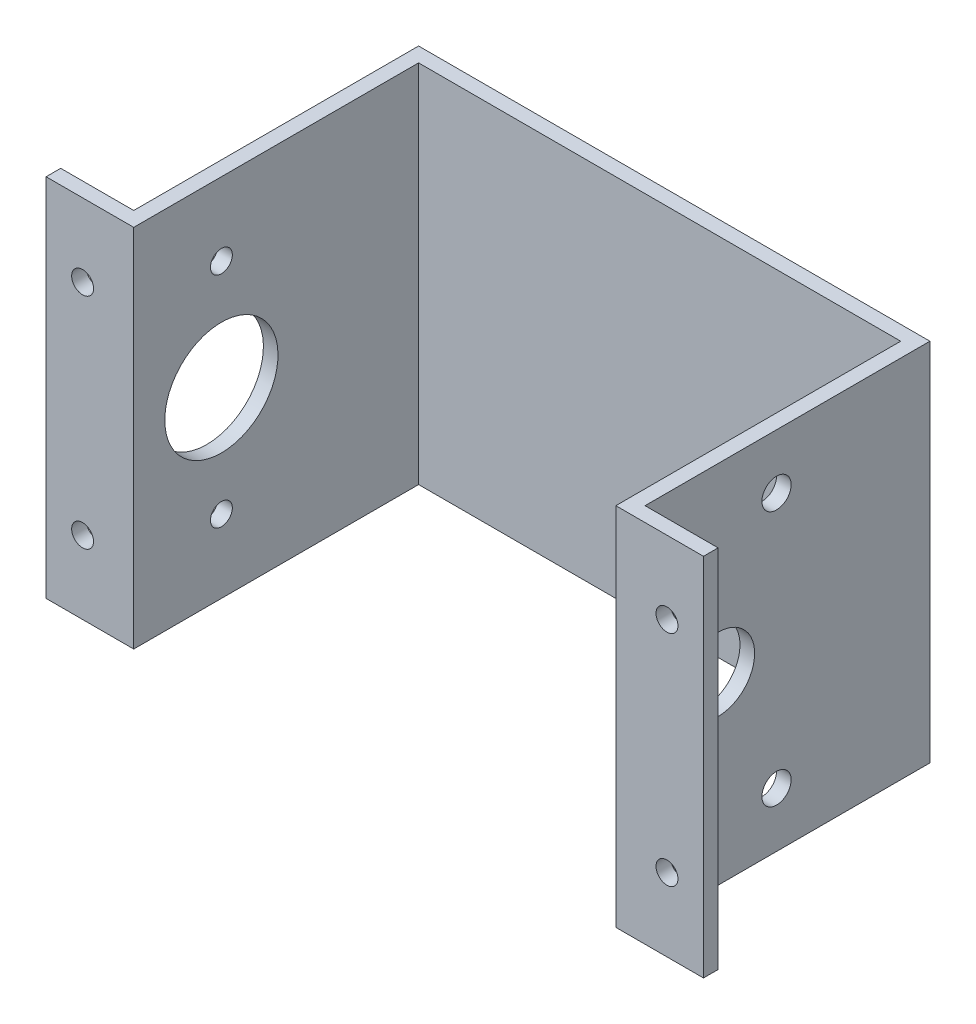
from build123d import *

# Parameters (mm, degrees)
SKETCH1_W           = 70
SKETCH1_H           = 50
BOSS_EXTRUDE1_DEPTH = 2
SKETCH2_W           = 2
SKETCH2_H           = 50
BOSS_EXTRUDE2_DEPTH = 37
SKETCH3_W           = 12
SKETCH3_H           = 50
BOSS_EXTRUDE3_DEPTH = 2
SKETCH4_R           = 5
SKETCH4_R_2         = 2
CUT_EXTRUDE1_DEPTH  = 2
SKETCH5_R           = 7.75
SKETCH5_R_2         = 1.5
CUT_EXTRUDE2_DEPTH  = 2
SKETCH6_R           = 1.5
CUT_EXTRUDE3_DEPTH  = 2


with BuildPart() as part:
    # Sketch1 → Boss-Extrude1 (new body)
    with BuildSketch(Plane.XY):
        Rectangle(SKETCH1_W, SKETCH1_H)
    extrude(amount=BOSS_EXTRUDE1_DEPTH)

    # Sketch2 → Boss-Extrude2 (add)
    with BuildSketch(Plane.XY.offset(2)):
        with Locations((34, 0)):
            Rectangle(SKETCH2_W, SKETCH2_H)
        with Locations((-34, 0)):
            Rectangle(SKETCH2_W, SKETCH2_H)
    extrude(amount=BOSS_EXTRUDE2_DEPTH)

    # Sketch3 → Boss-Extrude3 (add)
    with BuildSketch(Plane.XY.offset(39)):
        with Locations((39, 0)):
            Rectangle(SKETCH3_W, SKETCH3_H)
        with Locations((-39, 0)):
            Rectangle(SKETCH3_W, SKETCH3_H)
    extrude(amount=BOSS_EXTRUDE3_DEPTH)

    # Sketch4 → Cut-Extrude1 (cut)
    with BuildSketch(Plane(origin=(35, 0, 0), x_dir=(0, 0, -1), z_dir=(1, 0, 0))):
        with Locations(Location((-29, 0, 0), (0, 0, 90))):
            Circle(SKETCH4_R)
        with Locations(Location((-21, 17.5, 0), (0, 0, 90))):
            Circle(SKETCH4_R_2)
        with Locations(Location((-21, -17.5, 0), (0, 0, 90))):
            Circle(SKETCH4_R_2)
    extrude(amount=-CUT_EXTRUDE1_DEPTH, mode=Mode.SUBTRACT)

    # Sketch5 → Cut-Extrude2 (cut)
    with BuildSketch(Plane.ZY.offset(35)):
        with Locations(Location((29, 0, 0), (0, 0, 270))):
            Circle(SKETCH5_R)
        with Locations(Location((29, 15, 0), (0, 0, 270))):
            Circle(SKETCH5_R_2)
        with Locations(Location((29, -15, 0), (0, 0, 270))):
            Circle(SKETCH5_R_2)
    extrude(amount=-CUT_EXTRUDE2_DEPTH, mode=Mode.SUBTRACT)

    # Sketch6 → Cut-Extrude3 (cut)
    with BuildSketch(Plane(origin=(0, 0, 39), x_dir=(-1, 0, 0), z_dir=(0, 0, -1))):
        with Locations((-40, 15)):
            Circle(SKETCH6_R)
        with Locations(Location((-40, -15, 0), (0, 0, 180))):
            Circle(SKETCH6_R)
        with Locations((40, -15)):
            Circle(SKETCH6_R)
        with Locations(Location((40, 15, 0), (0, 0, 180))):
            Circle(SKETCH6_R)
    extrude(amount=-CUT_EXTRUDE3_DEPTH, mode=Mode.SUBTRACT)


solid = part.part
